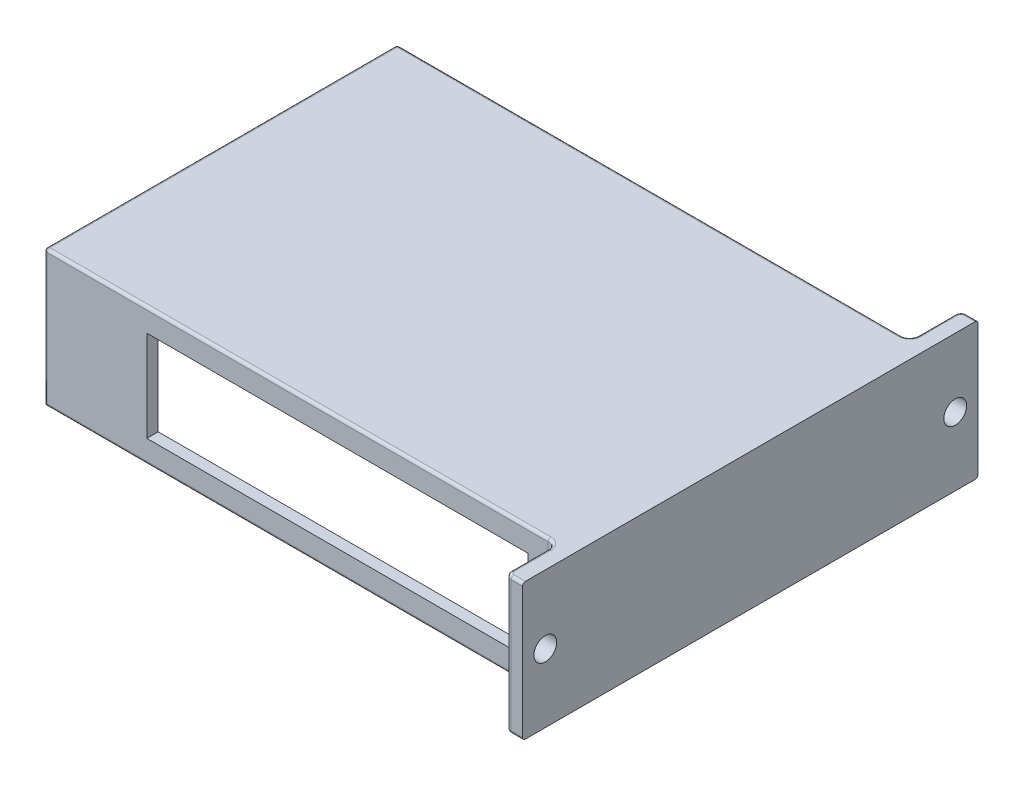
from build123d import *

# Parameters (mm, degrees)
SKIZZE1_W                       = 90
SKIZZE1_H                       = 24
AUFSATZ_LINEAR_AUSTRAGEN1_DEPTH = 62
SKIZZE2_W                       = 86
SKIZZE2_H                       = 58
SCHNITT_LINEAR_AUSTRAGEN1_DEPTH = 22
SKIZZE3_W                       = 58
SKIZZE3_H                       = 20
SCHNITT_LINEAR_AUSTRAGEN2_DEPTH = 5
SKIZZE4_W                       = 67
SKIZZE4_H                       = 16
SCHNITT_LINEAR_AUSTRAGEN3_DEPTH = 50
SKIZZE6_W                       = 3
SKIZZE6_H                       = 80
AUFSATZ_LINEAR_AUSTRAGEN2_DEPTH = 24
SKIZZE5_R                       = 2
SCHNITT_LINEAR_AUSTRAGEN6_DEPTH = 24
VERRUNDUNG1_R                   = 1.5
VERRUNDUNG2_R                   = 1
VERRUNDUNG3_R                   = 0.5


with BuildPart() as part:
    # Skizze1 → Aufsatz-Linear austragen1 (new body)
    with BuildSketch(Plane.XY):
        with Locations((-45, 12)):
            Rectangle(SKIZZE1_W, SKIZZE1_H)
    extrude(amount=-AUFSATZ_LINEAR_AUSTRAGEN1_DEPTH)

    # Skizze2 → Schnitt-Linear austragen1 (cut)
    with BuildSketch(Plane.XZ):
        with Locations((-45, -31)):
            Rectangle(SKIZZE2_W, SKIZZE2_H)
    extrude(amount=-SCHNITT_LINEAR_AUSTRAGEN1_DEPTH, mode=Mode.SUBTRACT)

    # Skizze3 → Schnitt-Linear austragen2 (cut)
    with BuildSketch(Plane.ZY.offset(90)):
        with Locations((-31, 10)):
            Rectangle(SKIZZE3_W, SKIZZE3_H)
    extrude(amount=-SCHNITT_LINEAR_AUSTRAGEN2_DEPTH, mode=Mode.SUBTRACT)

    # Skizze4 → Schnitt-Linear austragen3 (cut)
    with BuildSketch(Plane.XY):
        with Locations((-38.5, 12)):
            Rectangle(SKIZZE4_W, SKIZZE4_H)
    extrude(amount=-SCHNITT_LINEAR_AUSTRAGEN3_DEPTH, mode=Mode.SUBTRACT)

    # Skizze6 → Aufsatz-Linear austragen2 (add)
    with BuildSketch(Plane(origin=(0, 0, 0), x_dir=(1, 0, 0), z_dir=(0, 1, 0))):
        with Locations((1.5, 31)):
            Rectangle(SKIZZE6_W, SKIZZE6_H)
    extrude(amount=AUFSATZ_LINEAR_AUSTRAGEN2_DEPTH)

    # Skizze5 → Schnitt-Linear austragen6 (cut)
    with BuildSketch(Plane(origin=(0, 0, 0), x_dir=(0, 0, -1), z_dir=(1, 0, 0))):
        with Locations(Location((67, 12, 0), (0, 0, 180))):
            Circle(SKIZZE5_R)
        with Locations(Location((-5, 12, 0), (0, 0, 180))):
            Circle(SKIZZE5_R)
    extrude(amount=SCHNITT_LINEAR_AUSTRAGEN6_DEPTH, mode=Mode.SUBTRACT)

    # Verrundung1
    verrundung1_edges = [part.edges().sort_by_distance(p)[0] for p in [
        (0, 12, -62),
        (0, 12, 0),
    ]]
    fillet(verrundung1_edges, radius=VERRUNDUNG1_R)

    # Verrundung2
    verrundung2_edges = [part.edges().sort_by_distance(p)[0] for p in [
        (0, 12, -71),
        (0, 12, 9),
    ]]
    fillet(verrundung2_edges, radius=VERRUNDUNG2_R)

    # Verrundung3
    verrundung3_edges = [part.edges().sort_by_distance(p)[0] for p in [
        (-90, 12, -62),
        (-45.75, 0, -62),
        (0, 0, -66.75),
        (0, 24, -66.75),
        (2, 0, 9),
        (0.292893219, 0, 8.707106781),
        (0.292893219, 0, -70.707106781),
        (2, 24, 9),
        (0.292893219, 24, 8.707106781),
        (0.292893219, 24, -70.707106781),
        (-45.75, 0, 0),
        (-90, 12, 0),
        (2, 0, -71),
        (2, 24, -71),
        (-90, 24, -31),
        (-45.75, 24, 0),
        (0, 0, 4.75),
        (0, 24, 4.75),
        (-45.75, 24, -62),
        (-0.439339828, 24, 0.439339828),
        (-0.439339828, 0, 0.439339828),
        (-0.439339828, 24, -62.439339828),
        (-0.439339828, 0, -62.439339828),
    ]]
    fillet(verrundung3_edges, radius=VERRUNDUNG3_R)


solid = part.part
